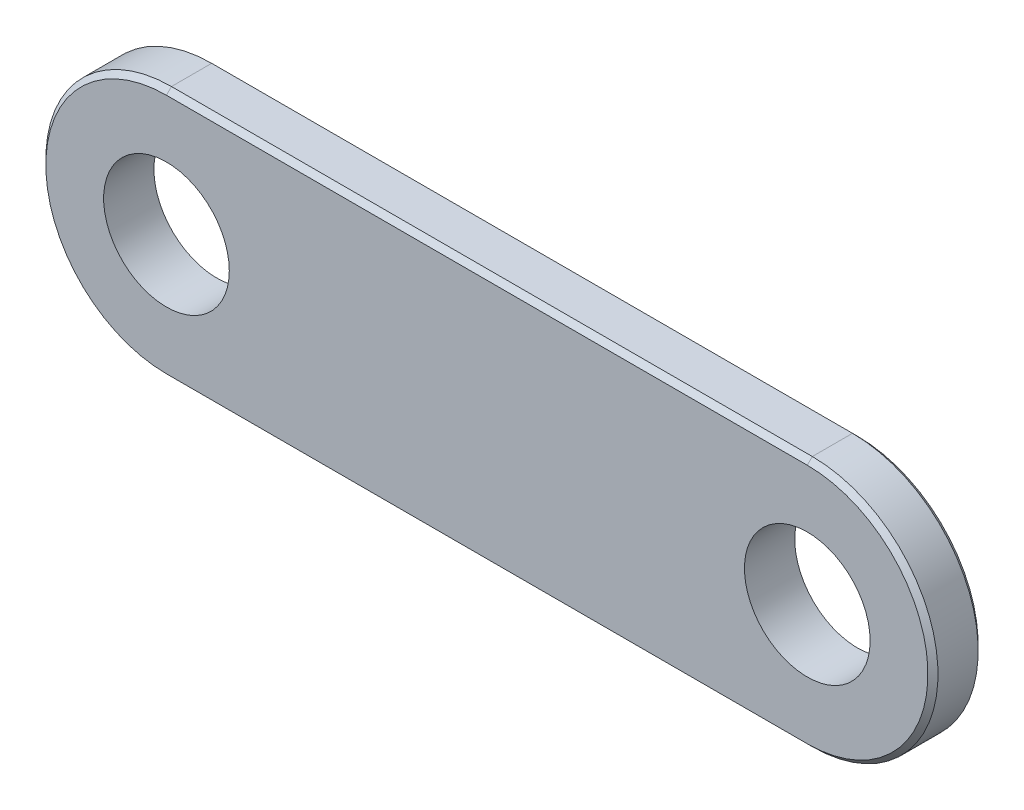
from build123d import *

# Parameters (mm, degrees)
SKETCH_1_R      = 25
EXTRUDE_1_DEPTH = 20
CHAMFER_1_SIZE  = 2


with BuildPart() as part:
    # 草圖1 → 填料-伸長1 (new body)
    with BuildSketch(Plane.XY):
        with BuildLine():
            Line((-127.5, 50), (127.5, 50))
            ThreePointArc((127.5, 50), (177.5, 0), (127.5, -50))
            Line((127.5, -50), (-127.5, -50))
            ThreePointArc((-127.5, -50), (-177.5, 0), (-127.5, 50))
        make_face()
        with Locations((-127.5, 0)):
            Circle(SKETCH_1_R, mode=Mode.SUBTRACT)
        with Locations((127.5, 0)):
            Circle(SKETCH_1_R, mode=Mode.SUBTRACT)
    extrude(amount=EXTRUDE_1_DEPTH)

    # 導角1
    chamfer_1_edges = [part.edges().sort_by_distance(p)[0] for p in [
        (177.5, 0, 20),
        (0, 50, 20),
        (-177.5, 0, 20),
        (0, 50, 0),
        (177.5, 0, 0),
        (0, -50, 0),
        (-177.5, 0, 0),
        (0, -50, 20),
    ]]
    chamfer(chamfer_1_edges, length=CHAMFER_1_SIZE)


solid = part.part
